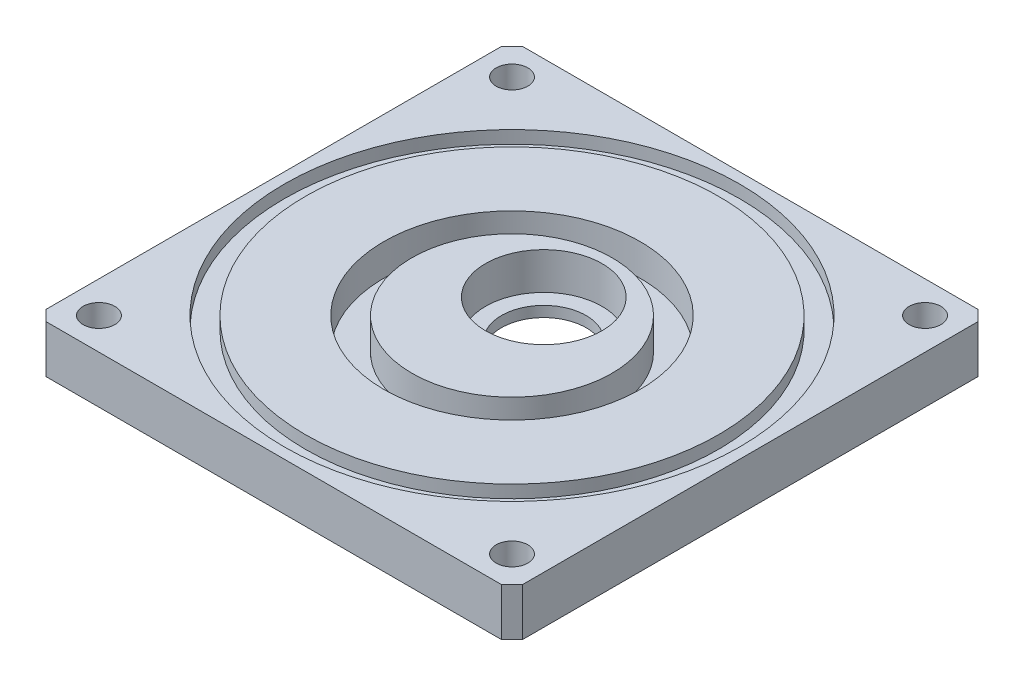
from build123d import *

# Parameters (mm, degrees)
SKETCH_1_W          = 45
SKETCH_1_H          = 45
EXTRUDE_1_DEPTH     = 4.5
SKETCH_2_R          = 5.5
CUT_EXTRUDE_1_DEPTH = 3.5
SKETCH_3_R          = 4
CUT_EXTRUDE_2_DEPTH = 33.011716605
SKETCH_4_R          = 12.1
SKETCH_4_R_2        = 9.45
CUT_EXTRUDE_3_DEPTH = 3
SKETCH_5_R          = 21.5
SKETCH_5_R_2        = 19.5
CUT_EXTRUDE_4_DEPTH = 1.2
CHAMFER_1_SIZE      = 1
SKETCH_6_R          = 1.5
CUT_EXTRUDE_5_DEPTH = 33.136427928


with BuildPart() as part:
    # 草图1 → 凸台-拉伸1 (new body)
    with BuildSketch(Plane(origin=(0, 0, 0), x_dir=(1, 0, 0), z_dir=(0, 1, 0))):
        Rectangle(SKETCH_1_W, SKETCH_1_H)
    extrude(amount=EXTRUDE_1_DEPTH)

    # 草图2 → 切除-拉伸1 (cut)
    with BuildSketch(Plane(origin=(0, 4.5, 0), x_dir=(1, 0, 0), z_dir=(0, 1, 0))):
        with Locations(Location((0, 3, 0), (0, 0, 270))):
            Circle(SKETCH_2_R)
    extrude(amount=-CUT_EXTRUDE_1_DEPTH, mode=Mode.SUBTRACT)

    # 草图3 → 切除-拉伸2 (cut, through all)
    with BuildSketch(Plane(origin=(0, 1, 0), x_dir=(1, 0, 0), z_dir=(0, 1, 0))):
        with Locations(Location((0, 3, 0), (0, 0, 270))):
            Circle(SKETCH_3_R)
    extrude(amount=-CUT_EXTRUDE_2_DEPTH, mode=Mode.SUBTRACT)

    # 草图4 → 切除-拉伸3 (cut)
    with BuildSketch(Plane(origin=(0, 4.5, 0), x_dir=(1, 0, 0), z_dir=(0, 1, 0))):
        with Locations(Location((0, 0, 0), (0, 0, 270))):
            Circle(SKETCH_4_R)
        with Locations(Location((0, 0, 0), (0, 0, 270))):
            Circle(SKETCH_4_R_2, mode=Mode.SUBTRACT)
    extrude(amount=-CUT_EXTRUDE_3_DEPTH, mode=Mode.SUBTRACT)

    # 草图5 → 切除-拉伸4 (cut)
    with BuildSketch(Plane(origin=(0, 4.5, 0), x_dir=(1, 0, 0), z_dir=(0, 1, 0))):
        with Locations(Location((0, 0, 0), (0, 0, 270))):
            Circle(SKETCH_5_R)
        with Locations(Location((0, 0, 0), (0, 0, 270))):
            Circle(SKETCH_5_R_2, mode=Mode.SUBTRACT)
    extrude(amount=-CUT_EXTRUDE_4_DEPTH, mode=Mode.SUBTRACT)

    # 倒角1
    chamfer_1_edges = [part.edges().sort_by_distance(p)[0] for p in [
        (22.5, 2.25, 22.5),
        (-22.5, 2.25, 22.5),
        (-22.5, 2.25, -22.5),
        (22.5, 2.25, -22.5),
    ]]
    chamfer(chamfer_1_edges, length=CHAMFER_1_SIZE)

    # 草图6 → 切除-拉伸5 (cut, through all)
    with BuildSketch(Plane.XZ):
        with Locations(Location((-19.5, 19.5, 0), (0, 0, 270))):
            Circle(SKETCH_6_R)
        with Locations(Location((19.5, 19.5, 0), (0, 0, 90))):
            Circle(SKETCH_6_R)
        with Locations(Location((19.5, -19.5, 0), (0, 0, 270))):
            Circle(SKETCH_6_R)
        with Locations(Location((-19.5, -19.5, 0), (0, 0, 90))):
            Circle(SKETCH_6_R)
    extrude(amount=-CUT_EXTRUDE_5_DEPTH, mode=Mode.SUBTRACT)


solid = part.part
